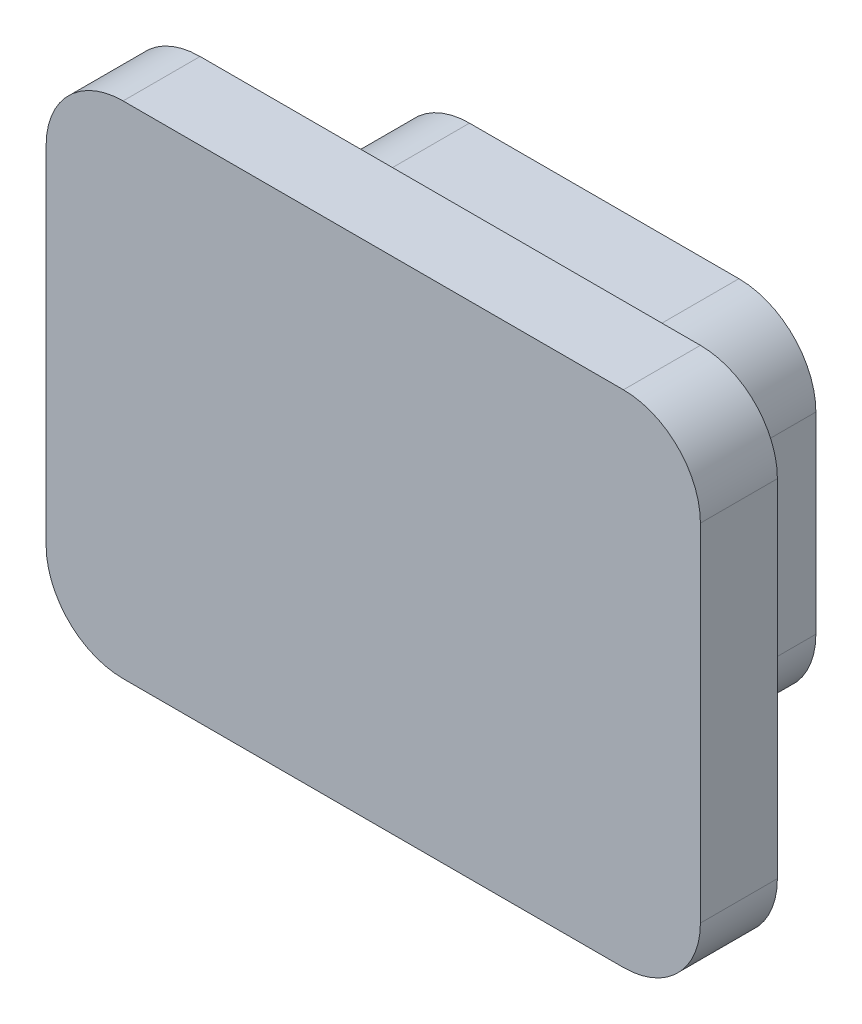
from build123d import *

# Parameters (mm, degrees)
EXTRUDE_1_DEPTH = 2
EXTRUDE_2_DEPTH = 1


with BuildPart() as part:
    # Эскиз1 → Бобышка-Вытянуть1 (new body)
    with BuildSketch(Plane.XY):
        with BuildLine():
            Line((-1.75, -2.25), (1.75, -2.25))
            ThreePointArc((1.75, -2.25), (2.457106781, -1.957106781), (2.75, -1.25))
            Line((2.75, -1.25), (2.75, 1.25))
            ThreePointArc((2.75, 1.25), (2.457106781, 1.957106781), (1.75, 2.25))
            Line((1.75, 2.25), (-1.75, 2.25))
            ThreePointArc((-1.75, 2.25), (-2.457106781, 1.957106781), (-2.75, 1.25))
            Line((-2.75, 1.25), (-2.75, -1.25))
            ThreePointArc((-2.75, -1.25), (-2.457106781, -1.957106781), (-1.75, -2.25))
        make_face()
    extrude(amount=EXTRUDE_1_DEPTH)

    # Эскиз2 → Бобышка-Вытянуть2 (add)
    with BuildSketch(Plane.XY.offset(2)):
        with BuildLine():
            Line((-3.25, -3.25), (3.25, -3.25))
            ThreePointArc((3.25, -3.25), (3.957106781, -2.957106781), (4.25, -2.25))
            Line((4.25, -2.25), (4.25, 2.25))
            ThreePointArc((4.25, 2.25), (3.957106781, 2.957106781), (3.25, 3.25))
            Line((3.25, 3.25), (-3.25, 3.25))
            ThreePointArc((-3.25, 3.25), (-3.957106781, 2.957106781), (-4.25, 2.25))
            Line((-4.25, 2.25), (-4.25, -2.25))
            ThreePointArc((-4.25, -2.25), (-3.957106781, -2.957106781), (-3.25, -3.25))
        make_face()
    extrude(amount=EXTRUDE_2_DEPTH)


solid = part.part
